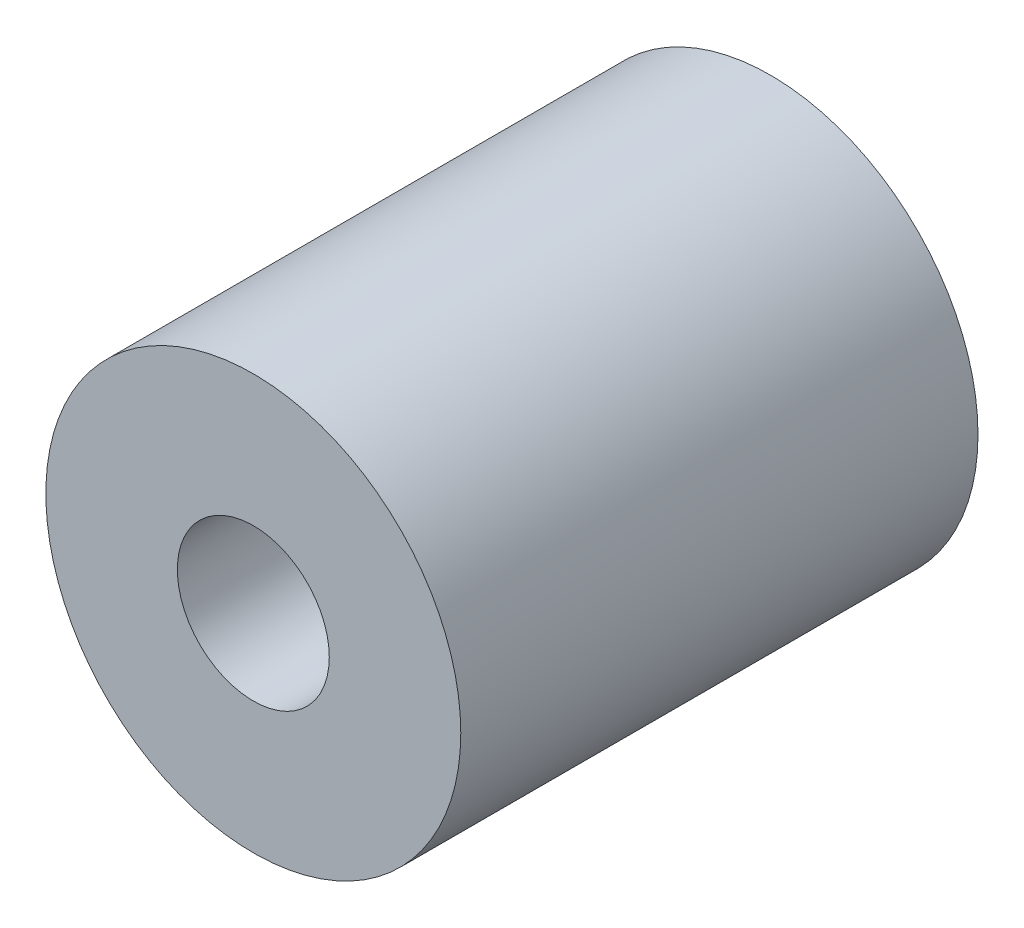
from build123d import *

# Parameters (mm, degrees)
SCHIZZO1_R                   = 71
SCHIZZO1_R_2                 = 26
ESTRUSIONE_ESTRUSIONE1_DEPTH = 177


with BuildPart() as part:
    # Schizzo1 → Estrusione-Estrusione1 (new body)
    with BuildSketch(Plane.XY):
        Circle(SCHIZZO1_R)
        Circle(SCHIZZO1_R_2, mode=Mode.SUBTRACT)
    extrude(amount=ESTRUSIONE_ESTRUSIONE1_DEPTH)


solid = part.part
